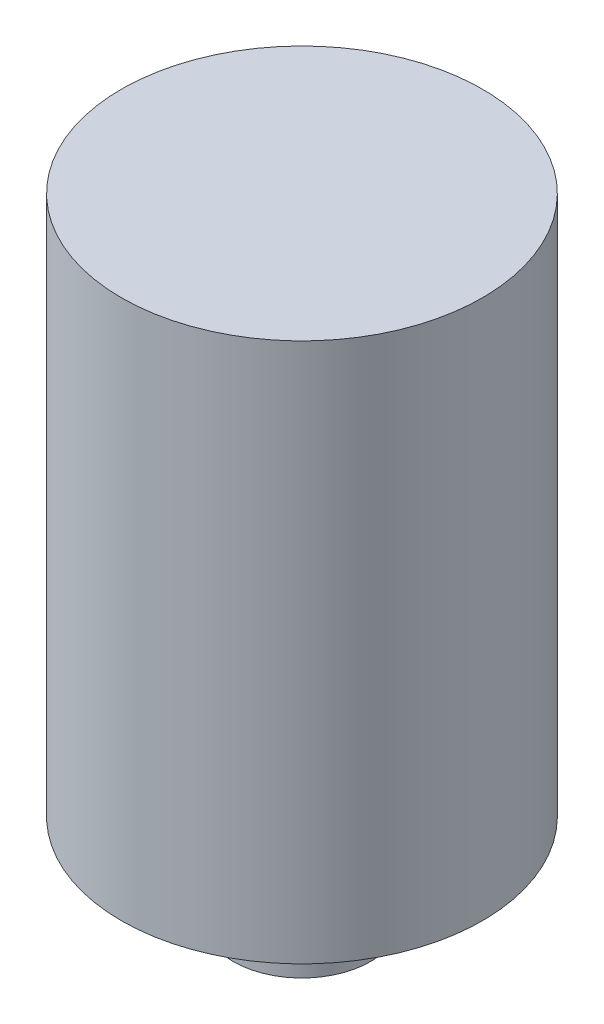
from build123d import *


with BuildPart() as part:
    # Sketch1 → Revolve1 (revolve)
    with BuildSketch(Plane.XY):
        Polygon((0, 0), (-1.5, 0), (-1.5, 2), (-3.95, 2), (-3.95, 13.8), (0, 13.8), align=None)
    revolve(axis=Axis((0, 0, 0), (0, -1, 0)))


solid = part.part
